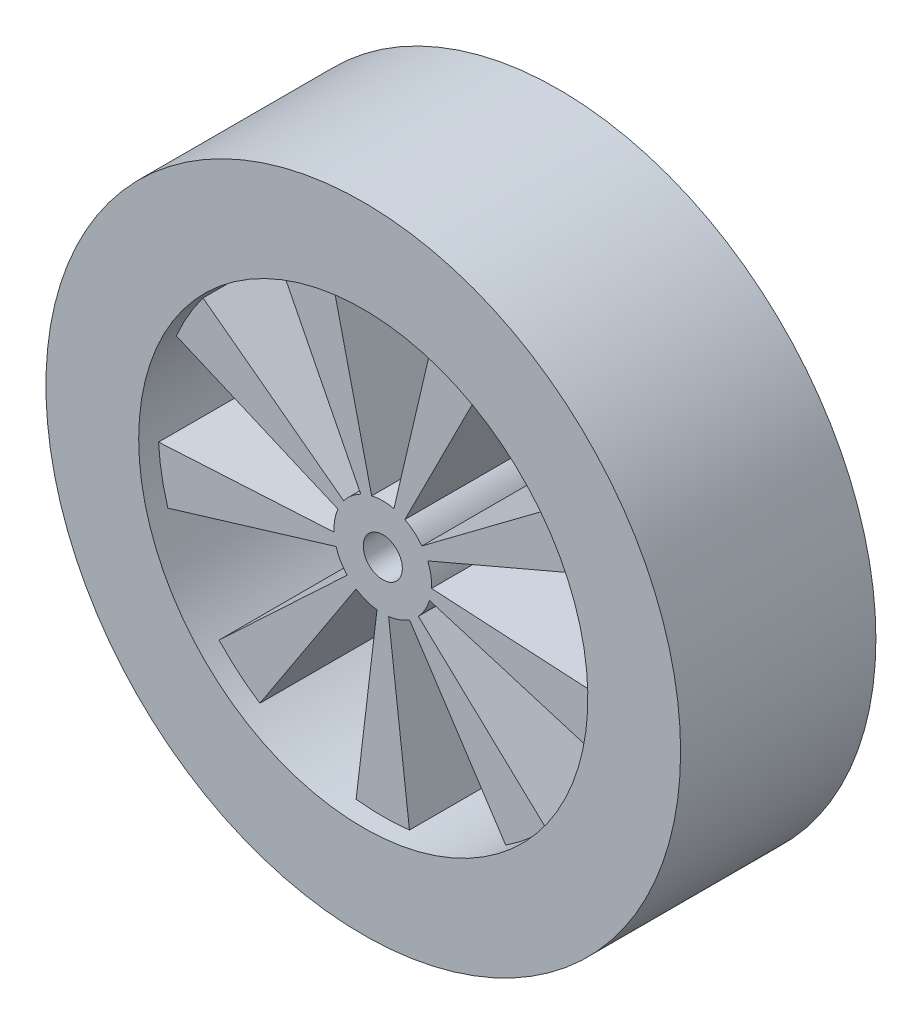
from build123d import *

# Parameters (mm, degrees)
CROQUIS1_R              = 32.5
SALIENTE_EXTRUIR1_DEPTH = 20
CROQUIS2_R              = 2
CORTAR_EXTRUIR1_DEPTH   = 20
CORTAR_EXTRUIR2_DEPTH   = 20
CROQUIS4_R              = 23
CORTAR_EXTRUIR3_DEPTH   = 2


with BuildPart() as part:
    # Croquis1 → Saliente-Extruir1 (new body)
    with BuildSketch(Plane.XY):
        Circle(CROQUIS1_R)
    extrude(amount=SALIENTE_EXTRUIR1_DEPTH)

    # Croquis2 → Cortar-Extruir1 (cut)
    with BuildSketch(Plane(origin=(0, 0, 0), x_dir=(-1, 0, 0), z_dir=(0, 0, -1))):
        Circle(CROQUIS2_R)
    extrude(amount=-CORTAR_EXTRUIR1_DEPTH, mode=Mode.SUBTRACT)

    # Croquis3 → Cortar-Extruir2 (cut)
    with BuildSketch(Plane.XY.offset(20)):
        with BuildLine():
            Line((1.140137938, 4.868273357), (5.244634516, 22.394057444))
            ThreePointArc((5.244634516, 22.394057444), (0, 23), (-5.244634516, 22.394057444))
            Line((-5.244634516, 22.394057444), (-1.140137938, 4.868273357))
            ThreePointArc((-1.140137938, 4.868273357), (0, 5), (1.140137938, 4.868273357))
        make_face()
        with BuildLine():
            Line((4.002662127, 2.996447213), (18.412245782, 13.78365718))
            ThreePointArc((18.412245782, 13.78365718), (14.784115023, 17.619022192), (10.376999529, 20.526029348))
            Line((10.376999529, 20.526029348), (2.255869463, 4.462180293))
            ThreePointArc((2.255869463, 4.462180293), (3.213938048, 3.830222216), (4.002662127, 2.996447213))
        make_face()
        with BuildLine():
            Line((4.992296221, -0.277449884), (22.964562618, -1.276269467))
            ThreePointArc((22.964562618, -1.276269467), (22.650578319, 3.993908086), (21.143120166, 9.053643998))
            Line((21.143120166, 9.053643998), (4.596330471, 1.968183478))
            ThreePointArc((4.596330471, 1.968183478), (4.924038765, 0.868240888), (4.992296221, -0.277449884))
        make_face()
        with BuildLine():
            Line((3.645979431, -3.421525097), (16.771505382, -15.739015446))
            ThreePointArc((16.771505382, -15.739015446), (19.918584287, -11.5), (22.016139898, -6.655041998))
            Line((22.016139898, -6.655041998), (4.786117369, -1.44674826))
            ThreePointArc((4.786117369, -1.44674826), (4.330127019, -2.5), (3.645979431, -3.421525097))
        make_face()
        with BuildLine():
            Line((0.593668344, -4.964630691), (2.730874383, -22.837301178))
            ThreePointArc((2.730874383, -22.837301178), (7.866463296, -21.612930278), (12.58756309, -19.249759881))
            Line((12.58756309, -19.249759881), (2.736426759, -4.184730409))
            ThreePointArc((2.736426759, -4.184730409), (1.710100717, -4.698463104), (0.593668344, -4.964630691))
        make_face()
        with BuildLine():
            Line((-2.736426759, -4.184730409), (-12.58756309, -19.249759881))
            ThreePointArc((-12.58756309, -19.249759881), (-7.866463296, -21.612930278), (-2.730874383, -22.837301178))
            Line((-2.730874383, -22.837301178), (-0.593668344, -4.964630691))
            ThreePointArc((-0.593668344, -4.964630691), (-1.710100717, -4.698463104), (-2.736426759, -4.184730409))
        make_face()
        with BuildLine():
            Line((-4.786117369, -1.44674826), (-22.016139898, -6.655041998))
            ThreePointArc((-22.016139898, -6.655041998), (-19.918584287, -11.5), (-16.771505382, -15.739015446))
            Line((-16.771505382, -15.739015446), (-3.645979431, -3.421525097))
            ThreePointArc((-3.645979431, -3.421525097), (-4.330127019, -2.5), (-4.786117369, -1.44674826))
        make_face()
        with BuildLine():
            Line((-4.596330471, 1.968183478), (-21.143120166, 9.053643998))
            ThreePointArc((-21.143120166, 9.053643998), (-22.650578319, 3.993908086), (-22.964562618, -1.276269467))
            Line((-22.964562618, -1.276269467), (-4.992296221, -0.277449884))
            ThreePointArc((-4.992296221, -0.277449884), (-4.924038765, 0.868240888), (-4.596330471, 1.968183478))
        make_face()
        with BuildLine():
            Line((-2.255869463, 4.462180293), (-10.376999529, 20.526029348))
            ThreePointArc((-10.376999529, 20.526029348), (-14.784115023, 17.619022192), (-18.412245782, 13.78365718))
            Line((-18.412245782, 13.78365718), (-4.002662127, 2.996447213))
            ThreePointArc((-4.002662127, 2.996447213), (-3.213938048, 3.830222216), (-2.255869463, 4.462180293))
        make_face()
    extrude(amount=-CORTAR_EXTRUIR2_DEPTH, mode=Mode.SUBTRACT)

    # Croquis4 → Cortar-Extruir3 (cut)
    with BuildSketch(Plane.XY.offset(20)):
        with Locations(Location((0, 0, 0), (0, 0, 356.819024652))):
            Circle(CROQUIS4_R)
    extrude(amount=-CORTAR_EXTRUIR3_DEPTH, mode=Mode.SUBTRACT)


solid = part.part
